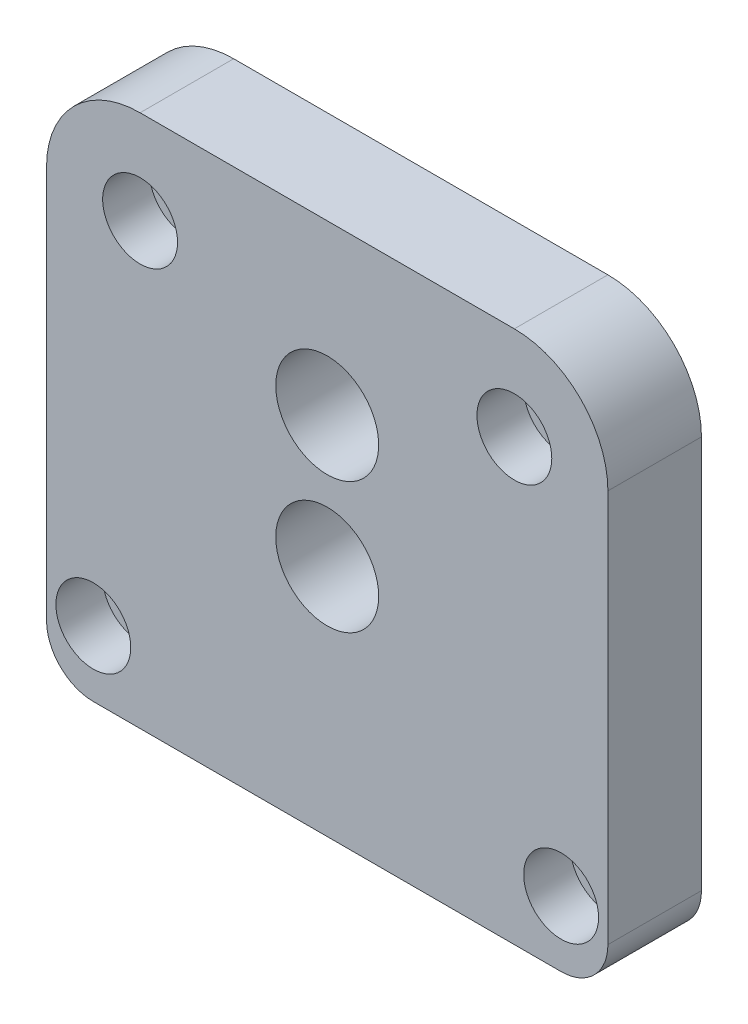
from build123d import *
from build123d.topology import SkipClean

# Parameters (mm, degrees)
SKETCH_1_W          = 60
SKETCH_1_H          = 50
SKETCH_1_R          = 15
EXTRUDE_5_DEPTH     = 5
SKETCH_4_W          = 60
SKETCH_4_H          = 50
SKETCH_4_R          = 5.5
EXTRUDE_6_DEPTH     = 5
SKETCH_5_R          = 1.6
CUT_EXTRUDE_1_DEPTH = 10
SKETCH_6_W          = 60
SKETCH_6_H          = 10
EXTRUDE_7_DEPTH     = 7
FILLET_3_R          = 10
SKETCH_7_R          = 4
CUT_EXTRUDE_2_DEPTH = 5
FILLET_5_R          = 10
FILLET_6_R          = 5
FILLET_7_R          = 5
CUT_EXTRUDE_4_DEPTH = 5
SKETCH_10_R         = 5.5
CUT_EXTRUDE_5_DEPTH = 5
EXTRUDE_START       = 3
SKETCH_11_R         = 5.5
EXTRUDE_8_DEPTH     = 3


with BuildPart() as part:
    # 草图1 → 凸台-拉伸5 (new body)
    with BuildSketch(Plane.XY):
        Rectangle(SKETCH_1_W, SKETCH_1_H)
        Circle(SKETCH_1_R, mode=Mode.SUBTRACT)
    extrude(amount=EXTRUDE_5_DEPTH)

    # 草图4 → 凸台-拉伸6 (add)
    with BuildSketch(Plane.XY.offset(5)):
        Rectangle(SKETCH_4_W, SKETCH_4_H)
        Circle(SKETCH_4_R, mode=Mode.SUBTRACT)
    extrude(amount=EXTRUDE_6_DEPTH)

    # 草图5 → 切除-拉伸1 (cut)
    with BuildSketch(Plane(origin=(0, 0, 0), x_dir=(-1, 0, 0), z_dir=(0, 0, -1))):
        with Locations((-20, 22)):
            Circle(SKETCH_5_R)
        with Locations((-25, -18)):
            Circle(SKETCH_5_R)
        with Locations((20, 22)):
            Circle(SKETCH_5_R)
        with Locations((25, -18)):
            Circle(SKETCH_5_R)
    extrude(amount=-CUT_EXTRUDE_1_DEPTH, mode=Mode.SUBTRACT)

    # 草图6 → 凸台-拉伸7 (add)
    with BuildSketch(Plane(origin=(0, 25, 0), x_dir=(1, 0, 0), z_dir=(0, 1, 0))):
        with Locations((0, -5)):
            Rectangle(SKETCH_6_W, SKETCH_6_H)
    extrude(amount=EXTRUDE_7_DEPTH)

    # 圆角3
    fillet_3_edges = [part.edges().sort_by_distance(p)[0] for p in [
        (-30, 32, 5),
    ]]
    fillet(fillet_3_edges, radius=FILLET_3_R)

    # 草图7 → 切除-拉伸2 (cut)
    with BuildSketch(Plane.XY.offset(10)):
        with Locations((-20, 22)):
            Circle(SKETCH_7_R)
        with Locations((20, 22)):
            Circle(SKETCH_7_R)
        with Locations((-25, -18)):
            Circle(SKETCH_7_R)
        with Locations((25, -18)):
            Circle(SKETCH_7_R)
    extrude(amount=-CUT_EXTRUDE_2_DEPTH, mode=Mode.SUBTRACT)

    # 圆角5
    fillet_5_edges = [part.edges().sort_by_distance(p)[0] for p in [
        (30, 32, 5),
    ]]
    fillet(fillet_5_edges, radius=FILLET_5_R)

    # 圆角6
    fillet_6_edges = [part.edges().sort_by_distance(p)[0] for p in [
        (-30, -25, 5),
    ]]
    fillet(fillet_6_edges, radius=FILLET_6_R)

    # 圆角7
    fillet_7_edges = [part.edges().sort_by_distance(p)[0] for p in [
        (30, -25, 5),
    ]]
    fillet(fillet_7_edges, radius=FILLET_7_R)

    # 草图8 → 切除-拉伸4 (cut)
    with BuildSketch(Plane(origin=(0, 0, 0), x_dir=(-1, 0, 0), z_dir=(0, 0, -1))):
        with BuildLine():
            ThreePointArc((-15, 0), (0, 15), (15, 0))
            Line((15, 0), (15, 14))
            ThreePointArc((15, 14), (0, 29), (-15, 14))
            Line((-15, 14), (-15, 0))
        make_face()
    extrude(amount=-CUT_EXTRUDE_4_DEPTH, mode=Mode.SUBTRACT)

    # 草图10 → 切除-拉伸5 (cut)
    with BuildSketch(Plane(origin=(0, 0, 5), x_dir=(-1, 0, 0), z_dir=(0, 0, -1))):
        with Locations((0, 14)):
            Circle(SKETCH_10_R)
    extrude(amount=-CUT_EXTRUDE_5_DEPTH, mode=Mode.SUBTRACT)

    # 草图11 → 凸台-拉伸8 (add)
    with SkipClean():  # the faces are left unmerged after this step: merging them gives an invalid solid
        with BuildSketch(Plane(origin=(0, 0, 5), x_dir=(-1, 0, 0), z_dir=(0, 0, -1)).offset(EXTRUDE_START)):
            with BuildLine():
                Line((-15, 14), (-15, 0))
                ThreePointArc((-15, 0), (0, -15), (15, 0))
                Line((15, 0), (15, 14))
                ThreePointArc((15, 14), (0, 29), (-15, 14))
            make_face()
            with Locations((0, 14)):
                Circle(SKETCH_11_R, mode=Mode.SUBTRACT)
            Circle(SKETCH_11_R, mode=Mode.SUBTRACT)
        extrude(amount=-EXTRUDE_8_DEPTH)


solid = part.part
